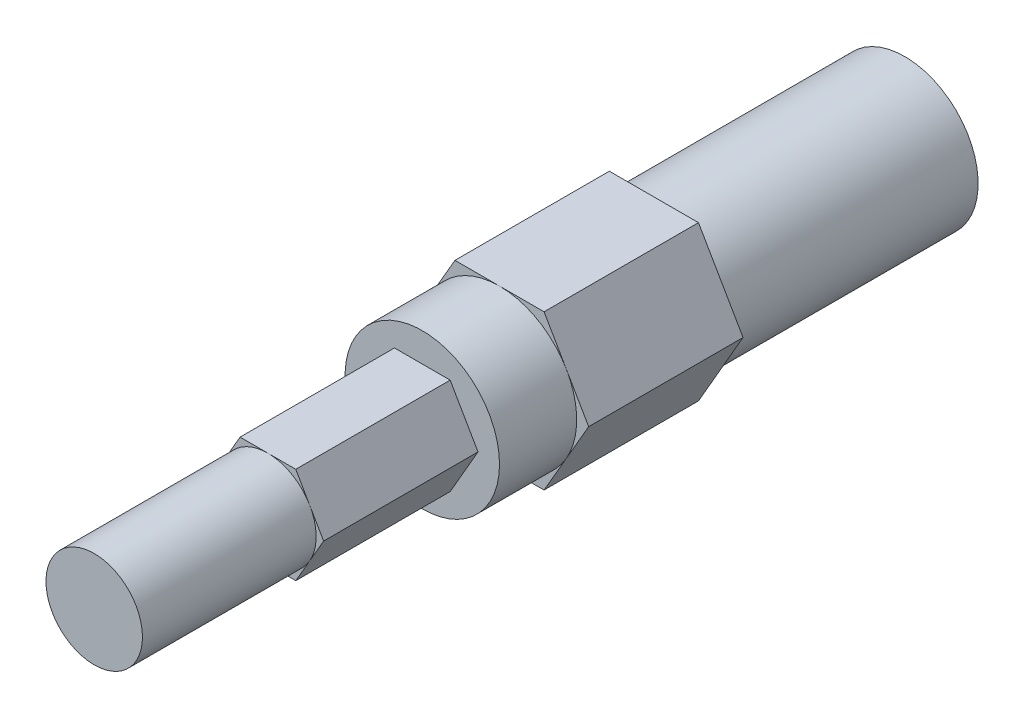
from build123d import *

# Parameters (mm, degrees)
SKETCH1_R           = 2.413
BOSS_EXTRUDE1_DEPTH = 13.335
BOSS_EXTRUDE2_DEPTH = 5.08
SKETCH3_R           = 2.413
CUT_EXTRUDE1_DEPTH  = 1.905
SKETCH4_R           = 2.54
BOSS_EXTRUDE3_DEPTH = 2.54
BOSS_EXTRUDE4_DEPTH = 5.08
SKETCH6_R           = 1.5875
BOSS_EXTRUDE5_DEPTH = 5.715
SKETCH7_R           = 2.413
CUT_EXTRUDE2_DEPTH  = 3.175


with BuildPart() as part:
    # Sketch1 → Boss-Extrude1 (new body)
    with BuildSketch(Plane.XY):
        Circle(SKETCH1_R)
    extrude(amount=BOSS_EXTRUDE1_DEPTH)

    # Sketch2 → Boss-Extrude2 (add)
    with BuildSketch(Plane.XY.offset(13.335)):
        Polygon((2.932939367, 0), (1.466469684, 2.54), (-1.466469684, 2.54), (-2.932939367, 0), (-1.466469684, -2.54), (1.466469684, -2.54), align=None)
    extrude(amount=BOSS_EXTRUDE2_DEPTH)

    # Sketch3 → Cut-Extrude1 (cut)
    with BuildSketch(Plane(origin=(0, 0, 0), x_dir=(-1, 0, 0), z_dir=(0, 0, -1))):
        Circle(SKETCH3_R)
    extrude(amount=-CUT_EXTRUDE1_DEPTH, mode=Mode.SUBTRACT)

    # Sketch4 → Boss-Extrude3 (add)
    with BuildSketch(Plane.XY.offset(18.415)):
        with Locations(Location((0, 0, 0), (0, 0, 150))):
            Circle(SKETCH4_R)
    extrude(amount=BOSS_EXTRUDE3_DEPTH)

    # Sketch5 → Boss-Extrude4 (add)
    with BuildSketch(Plane.XY.offset(20.955)):
        Polygon((1.833087105, 0), (0.916543552, 1.5875), (-0.916543552, 1.5875), (-1.833087105, 0), (-0.916543552, -1.5875), (0.916543552, -1.5875), align=None)
    extrude(amount=BOSS_EXTRUDE4_DEPTH)

    # Sketch6 → Boss-Extrude5 (add)
    with BuildSketch(Plane.XY.offset(26.035)):
        with Locations(Location((0, 0, 0), (0, 0, 150))):
            Circle(SKETCH6_R)
    extrude(amount=BOSS_EXTRUDE5_DEPTH)

    # Sketch7 → Cut-Extrude2 (cut)
    with BuildSketch(Plane(origin=(0, 0, 1.905), x_dir=(-1, 0, 0), z_dir=(0, 0, -1))):
        Circle(SKETCH7_R)
    extrude(amount=-CUT_EXTRUDE2_DEPTH, mode=Mode.SUBTRACT)


solid = part.part
